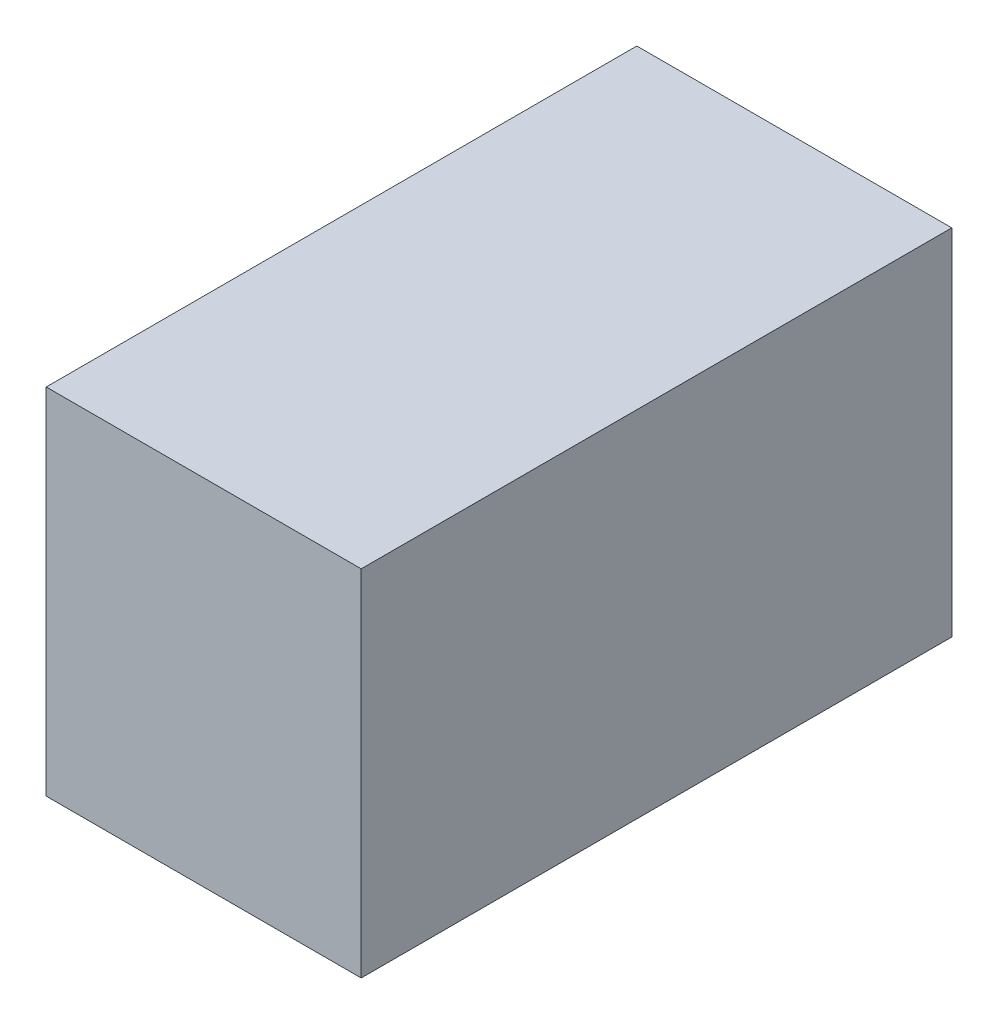
from build123d import *

# Parameters (mm, degrees)
SKETCH1_W           = 101.6
SKETCH1_H           = 114.3
BOSS_EXTRUDE1_DEPTH = 190.5


with BuildPart() as part:
    # Sketch1 → Boss-Extrude1 (new body)
    with BuildSketch(Plane.XY):
        with Locations((50.8, 57.15)):
            Rectangle(SKETCH1_W, SKETCH1_H)
    extrude(amount=BOSS_EXTRUDE1_DEPTH)


solid = part.part
